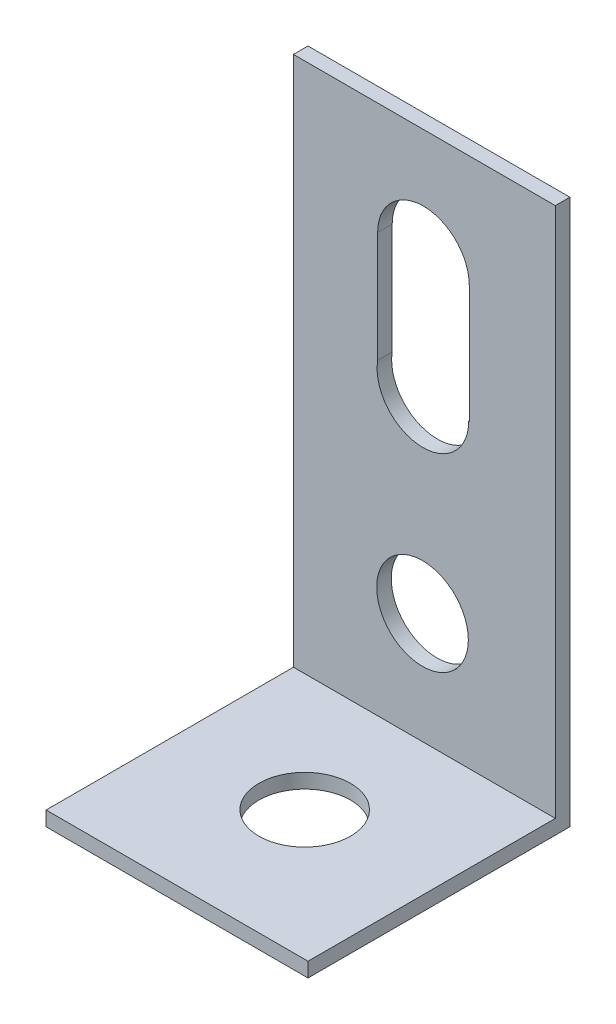
from build123d import *

# Parameters (mm, degrees)
SKETCH1_W           = 22.86
SKETCH1_H           = 22.86
BOSS_EXTRUDE1_DEPTH = 1.27
SKETCH3_W           = 22.86
SKETCH3_H           = 1.27
BOSS_EXTRUDE2_DEPTH = 47.593039283
SKETCH4_R           = 4
CUT_EXTRUDE2_DEPTH  = 10
SKETCH5_R           = 4
SKETCH5_W           = 8
SKETCH5_H           = 10.275395712
CUT_EXTRUDE3_DEPTH  = 2.54
SCALE2_SCALE        = 2.1


with BuildPart() as part:
    # Sketch1 → Boss-Extrude1 (new body)
    with BuildSketch(Plane(origin=(0, 0, 0), x_dir=(1, 0, 0), z_dir=(0, 1, 0))):
        with Locations((0.164586144, 0.124003255)):
            Rectangle(SKETCH1_W, SKETCH1_H)
    extrude(amount=BOSS_EXTRUDE1_DEPTH)

    # Sketch3 → Boss-Extrude2 (add)
    with BuildSketch(Plane.XZ):
        with Locations((0.164586144, -10.919003255)):
            Rectangle(SKETCH3_W, SKETCH3_H)
    extrude(amount=-BOSS_EXTRUDE2_DEPTH)

    # Sketch4 → Cut-Extrude2 (cut)
    with BuildSketch(Plane(origin=(0, 1.27, 0), x_dir=(1, 0, 0), z_dir=(0, 1, 0))):
        with Locations(Location((0, 0, 0), (0, 0, 270))):
            Circle(SKETCH4_R)
    extrude(amount=-CUT_EXTRUDE2_DEPTH, mode=Mode.SUBTRACT)

    # Sketch5 → Cut-Extrude3 (cut)
    with BuildSketch(Plane.XY.offset(-10.284003255)):
        with Locations((0.082545716, 37.799520725)):
            Circle(SKETCH5_R)
        with Locations((0.034649226, 27.524125013)):
            Circle(SKETCH5_R)
        with Locations((0.082545716, 32.661822869)):
            Rectangle(SKETCH5_W, SKETCH5_H)
        with BuildLine():
            ThreePointArc((4.034649226, 27.524125013), (0.344153636, 31.512132914), (-3.917454284, 28.141278028))
            Line((-3.917454284, 28.141278028), (-3.917454284, 27.524125013))
            Line((-3.917454284, 27.524125013), (4.034649226, 27.524125013))
        make_face()
        with BuildLine():
            Line((-3.917454284, 27.524125013), (-3.917454284, 28.141278028))
            ThreePointArc((-3.917454284, 28.141278028), (-0.274855184, 23.536117112), (4.034649226, 27.524125013))
            Line((4.034649226, 27.524125013), (-3.917454284, 27.524125013))
        make_face()
        with Locations((0, 10.961912138)):
            Circle(SKETCH5_R)
        with BuildLine():
            ThreePointArc((4.082545716, 37.799520725), (0.082545716, 41.799520725), (-3.917454284, 37.799520725))
            Line((-3.917454284, 37.799520725), (4.082545716, 37.799520725))
        make_face()
        with BuildLine():
            Line((4.082545716, 37.799520725), (-3.917454284, 37.799520725))
            ThreePointArc((-3.917454284, 37.799520725), (0.082545716, 33.799520725), (4.082545716, 37.799520725))
        make_face()
    extrude(amount=-CUT_EXTRUDE3_DEPTH, mode=Mode.SUBTRACT)


with BuildPart() as part_1:
    # Scale2: scaled about (0, 0, 0)
    add(part.part.scale(SCALE2_SCALE))


solid = part_1.part
